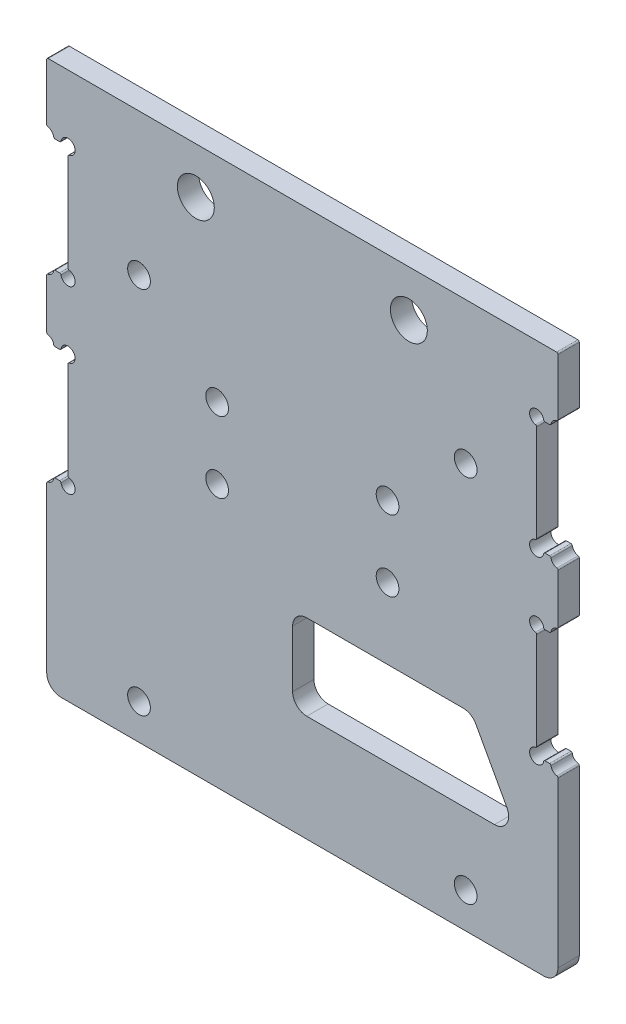
from build123d import *
from OCP.BRepFilletAPI import BRepFilletAPI_MakeFillet

# Parameters (mm, degrees)
SKETCH_1_R          = 2.6
EXTRUDE_1_DEPTH     = 3
FILLET_1_R1         = 0.2
FILLET_1_R2         = 2
SKETCH_2_R          = 1.6
CUT_EXTRUDE_1_DEPTH = 10
CUT_EXTRUDE_4_DEPTH = 3
SKETCH_8_R          = 1.6
CUT_EXTRUDE_5_DEPTH = 3
FILLET_2_R          = 2
SKETCH_10_R         = 1.6
CUT_EXTRUDE_6_DEPTH = 10


with BuildPart() as part:
    # 草图1 → 凸台-拉伸1 (new body)
    with BuildSketch(Plane.XY):
        with BuildLine():
            Line((36, 0), (-36, 0))
            Line((-36, 0), (-36, -8.333333333))
            ThreePointArc((-36, -8.333333333), (-35.292893219, -8.626226552), (-35, -9.333333333))
            Line((-35, -9.333333333), (-34, -9.333333333))
            ThreePointArc((-34, -9.333333333), (-32.292893219, -8.626226552), (-33, -10.333333333))
            Line((-33, -10.333333333), (-33, -24.333333333))
            ThreePointArc((-33, -24.333333333), (-32.292893219, -26.040440115), (-34, -25.333333333))
            Line((-34, -25.333333333), (-35, -25.333333333))
            ThreePointArc((-35, -25.333333333), (-35.292893219, -26.040440115), (-36, -26.333333333))
            Line((-36, -26.333333333), (-36, -33.666666667))
            ThreePointArc((-36, -33.666666667), (-35.292893219, -33.959559885), (-35, -34.666666667))
            Line((-35, -34.666666667), (-34, -34.666666667))
            ThreePointArc((-34, -34.666666667), (-32.292893219, -33.959559885), (-33, -35.666666667))
            Line((-33, -35.666666667), (-33, -49.666666667))
            ThreePointArc((-33, -49.666666667), (-32.292893219, -51.373773448), (-34, -50.666666667))
            Line((-34, -50.666666667), (-35, -50.666666667))
            ThreePointArc((-35, -50.666666667), (-35.292893219, -51.373773448), (-36, -51.666666667))
            Line((-36, -51.666666667), (-36, -77))
            Line((-36, -77), (36, -77))
            Line((36, -77), (36, -51.666666667))
            ThreePointArc((36, -51.666666667), (35.292893219, -51.373773448), (35, -50.666666667))
            Line((35, -50.666666667), (34, -50.666666667))
            ThreePointArc((34, -50.666666667), (32.292893219, -51.373773448), (33, -49.666666667))
            Line((33, -49.666666667), (33, -35.666666667))
            ThreePointArc((33, -35.666666667), (32.292893219, -33.959559885), (34, -34.666666667))
            Line((34, -34.666666667), (35, -34.666666667))
            ThreePointArc((35, -34.666666667), (35.292893219, -33.959559885), (36, -33.666666667))
            Line((36, -33.666666667), (36, -26.333333333))
            ThreePointArc((36, -26.333333333), (35.292893219, -26.040440115), (35, -25.333333333))
            Line((35, -25.333333333), (34, -25.333333333))
            ThreePointArc((34, -25.333333333), (32.292893219, -26.040440115), (33, -24.333333333))
            Line((33, -24.333333333), (33, -10.333333333))
            ThreePointArc((33, -10.333333333), (32.292893219, -8.626226552), (34, -9.333333333))
            Line((34, -9.333333333), (35, -9.333333333))
            ThreePointArc((35, -9.333333333), (35.292893219, -8.626226552), (36, -8.333333333))
            Line((36, -8.333333333), (36, 0))
        make_face()
        with Locations((-15, -6.5)):
            Circle(SKETCH_1_R, mode=Mode.SUBTRACT)
        with Locations((15, -6.5)):
            Circle(SKETCH_1_R, mode=Mode.SUBTRACT)
    extrude(amount=EXTRUDE_1_DEPTH)

    # 圆角1: one fillet with a radius per group of edges: ONE call of the kernel's fillet builder (fillet() takes one radius for all edges)
    fillet_1_edges_1 = [part.edges().sort_by_distance(p)[0] for p in [
        (-35, -9.333333333, 1.5),
        (-34, -9.333333333, 1.5),
        (33, -10.333333333, 1.5),
        (34, -9.333333333, 1.5),
        (35, -9.333333333, 1.5),
        (36, -8.333333333, 1.5),
        (36, 0, 1.5),
        (-36, 0, 1.5),
        (-36, -8.333333333, 1.5),
        (-33, -10.333333333, 1.5),
        (-33, -24.333333333, 1.5),
        (-34, -25.333333333, 1.5),
        (-35, -25.333333333, 1.5),
        (-36, -26.333333333, 1.5),
        (-36, -33.666666667, 1.5),
        (-35, -34.666666667, 1.5),
        (-34, -34.666666667, 1.5),
        (-33, -35.666666667, 1.5),
        (-33, -49.666666667, 1.5),
        (-34, -50.666666667, 1.5),
        (-35, -50.666666667, 1.5),
        (-36, -51.666666667, 1.5),
        (36, -51.666666667, 1.5),
        (35, -50.666666667, 1.5),
        (34, -50.666666667, 1.5),
        (33, -49.666666667, 1.5),
        (33, -35.666666667, 1.5),
        (34, -34.666666667, 1.5),
        (35, -34.666666667, 1.5),
        (36, -33.666666667, 1.5),
        (36, -26.333333333, 1.5),
        (35, -25.333333333, 1.5),
        (34, -25.333333333, 1.5),
        (33, -24.333333333, 1.5),
    ]]
    fillet_1_edges_2 = [part.edges().sort_by_distance(p)[0] for p in [
        (-36, -77, 1.5),
        (36, -77, 1.5),
    ]]
    fillet_1 = BRepFilletAPI_MakeFillet(part.part.solid().wrapped)
    for e in fillet_1_edges_1:
        fillet_1.Add(FILLET_1_R1, e.wrapped)
    for e in fillet_1_edges_2:
        fillet_1.Add(FILLET_1_R2, e.wrapped)
    add(Compound.cast(fillet_1.Shape()), mode=Mode.REPLACE)

    # 草图2 → 切除-拉伸1 (cut)
    with BuildSketch(Plane.XY.offset(3)):
        with Locations((-23, -20)):
            Circle(SKETCH_2_R)
        with Locations((23, -20)):
            Circle(SKETCH_2_R)
    extrude(amount=-CUT_EXTRUDE_1_DEPTH, mode=Mode.SUBTRACT)

    # 草图4 → 切除-拉伸4 (cut)
    with BuildSketch(Plane.XY.offset(3)):
        Polygon((-1.373235094, -62), (30.420434699, -62), (23.858682277, -50), (-1.373235094, -50), align=None)
    extrude(amount=-CUT_EXTRUDE_4_DEPTH, mode=Mode.SUBTRACT)

    # 草图8 → 切除-拉伸5 (cut)
    with BuildSketch(Plane.XY.offset(3)):
        with Locations((23, -72)):
            Circle(SKETCH_8_R)
        with Locations((-23, -72)):
            Circle(SKETCH_8_R)
    extrude(amount=-CUT_EXTRUDE_5_DEPTH, mode=Mode.SUBTRACT)

    # 圆角2
    fillet_2_edges = [part.edges().sort_by_distance(p)[0] for p in [
        (23.858682277, -50, 1.5),
        (-1.373235094, -62, 1.5),
        (30.420434699, -62, 1.5),
        (-1.373235094, -50, 1.5),
    ]]
    fillet(fillet_2_edges, radius=FILLET_2_R)

    # 草图10 → 切除-拉伸6 (cut)
    with BuildSketch(Plane.XY.offset(3)):
        with Locations((-12, -30)):
            Circle(SKETCH_10_R)
        with Locations((-12, -40)):
            Circle(SKETCH_10_R)
        with Locations((12, -40)):
            Circle(SKETCH_10_R)
        with Locations((12, -30)):
            Circle(SKETCH_10_R)
    extrude(amount=-CUT_EXTRUDE_6_DEPTH, mode=Mode.SUBTRACT)


solid = part.part
